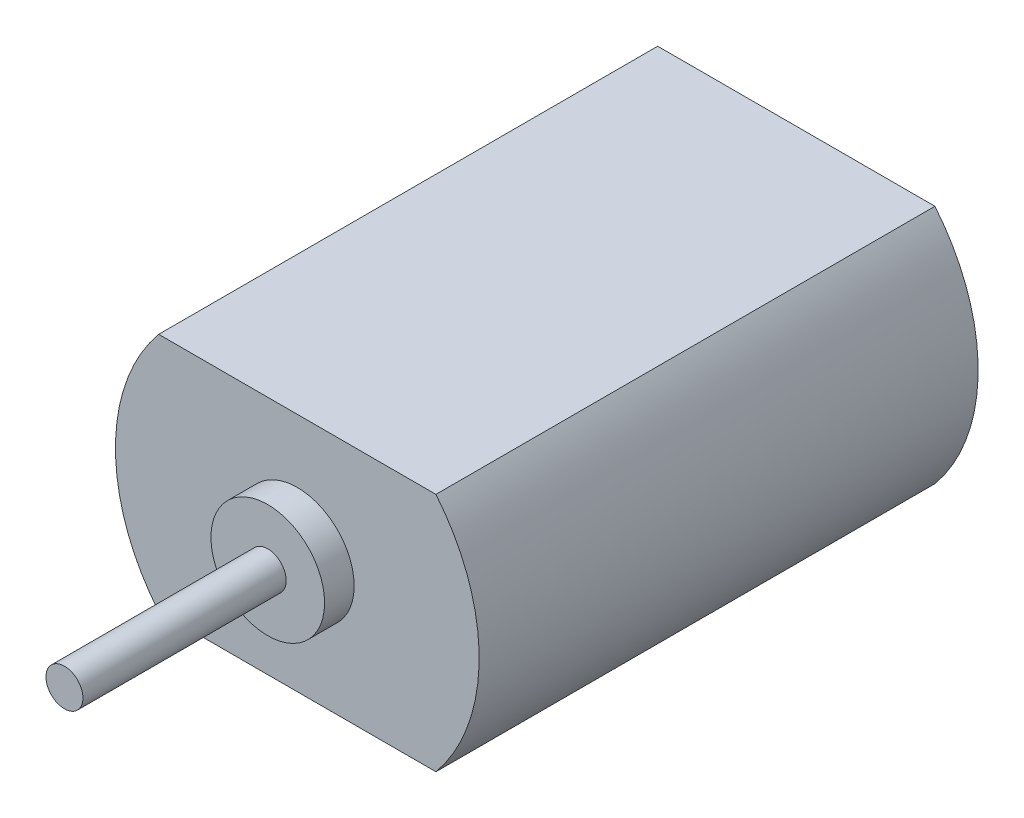
from build123d import *

# Parameters (mm, degrees)
SKETCH1_W           = 15
SKETCH1_H           = 13
BOSS_EXTRUDE1_DEPTH = 27
SKETCH2_R           = 3.075
BOSS_EXTRUDE2_DEPTH = 1.6
SKETCH3_R           = 1
BOSS_EXTRUDE3_DEPTH = 11


with BuildPart() as part:
    # Sketch1 → Boss-Extrude1 (new body)
    with BuildSketch(Plane.XY):
        Rectangle(SKETCH1_W, SKETCH1_H)
        with BuildLine():
            ThreePointArc((7.5, 6.5), (9.83933845, 0), (7.5, -6.5))
            Line((7.5, -6.5), (7.5, 6.5))
        make_face()
        with BuildLine():
            Line((-7.5, -6.5), (-7.5, 6.5))
            ThreePointArc((-7.5, 6.5), (-9.83933845, 0), (-7.5, -6.5))
        make_face()
    extrude(amount=BOSS_EXTRUDE1_DEPTH)

    # Sketch2 → Boss-Extrude2 (add)
    with BuildSketch(Plane.XY.offset(27)):
        Circle(SKETCH2_R)
    extrude(amount=BOSS_EXTRUDE2_DEPTH)

    # Sketch3 → Boss-Extrude3 (add)
    with BuildSketch(Plane.XY.offset(28.6)):
        Circle(SKETCH3_R)
    extrude(amount=BOSS_EXTRUDE3_DEPTH)


solid = part.part
